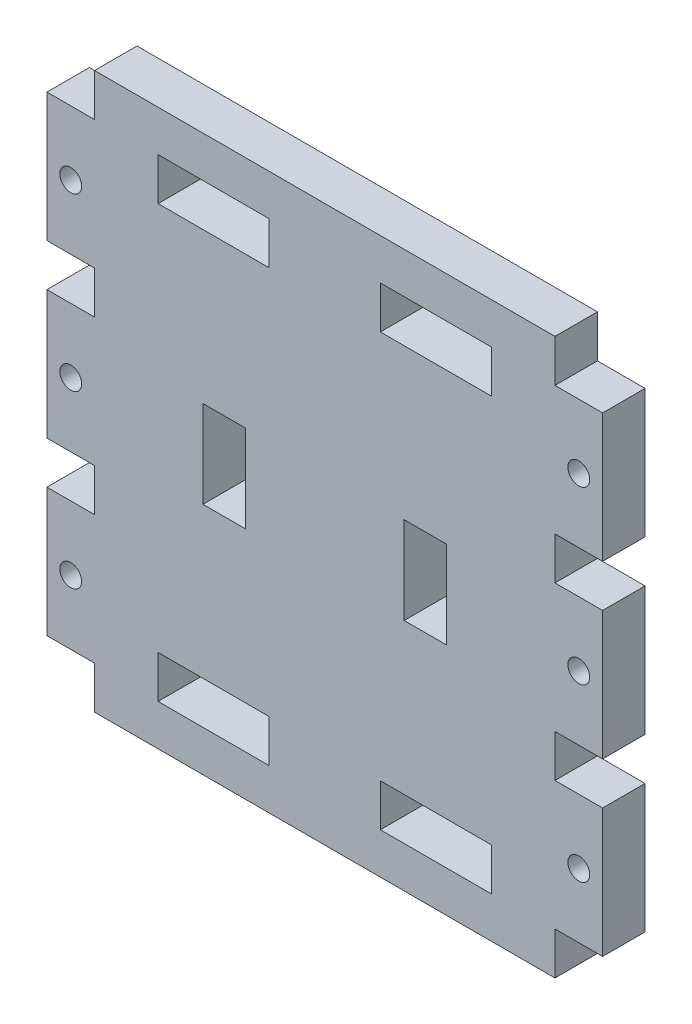
from build123d import *

# Parameters (mm, degrees)
MODEL_R             = 1.375
MODEL_W             = 14
MODEL_H             = 5.35
MODEL_W_2           = 5.35
MODEL_H_2           = 11
BOSS_EXTRUDE1_DEPTH = 5.35


with BuildPart() as part:
    # Model → Boss-Extrude1 (new body)
    with BuildSketch(Plane.XY):
        Polygon((0, 0), (58, 0), (58, 5.35), (64, 5.35), (64, 21.55), (58, 21.55), (58, 26.9), (64, 26.9), (64, 43.1), (58, 43.1), (58, 48.45), (64, 48.45), (64, 64.65), (58, 64.65), (58, 70), (0, 70), (0, 64.65), (-6, 64.65), (-6, 48.45), (0, 48.45), (0, 43.1), (-6, 43.1), (-6, 26.9), (0, 26.9), (0, 21.55), (-6, 21.55), (-6, 5.35), (0, 5.35), align=None)
        with Locations((-3, 56.55)):
            Circle(MODEL_R, mode=Mode.SUBTRACT)
        with Locations(Location((61, 56.55, 0), (0, 0, 180))):
            Circle(MODEL_R, mode=Mode.SUBTRACT)
        with Locations((61, 13.45)):
            Circle(MODEL_R, mode=Mode.SUBTRACT)
        with Locations(Location((-3, 13.45, 0), (0, 0, 180))):
            Circle(MODEL_R, mode=Mode.SUBTRACT)
        with Locations((-3, 35)):
            Circle(MODEL_R, mode=Mode.SUBTRACT)
        with Locations(Location((61, 35, 0), (0, 0, 180))):
            Circle(MODEL_R, mode=Mode.SUBTRACT)
        with Locations((15, 62.155)):
            Rectangle(MODEL_W, MODEL_H, mode=Mode.SUBTRACT)
        with Locations((43, 62.155)):
            Rectangle(MODEL_W, MODEL_H, mode=Mode.SUBTRACT)
        with Locations((43, 7.845)):
            Rectangle(MODEL_W, MODEL_H, mode=Mode.SUBTRACT)
        with Locations((15, 7.845)):
            Rectangle(MODEL_W, MODEL_H, mode=Mode.SUBTRACT)
        with Locations((16.325, 35)):
            Rectangle(MODEL_W_2, MODEL_H_2, mode=Mode.SUBTRACT)
        with Locations((41.675, 35)):
            Rectangle(MODEL_W_2, MODEL_H_2, mode=Mode.SUBTRACT)
    extrude(amount=BOSS_EXTRUDE1_DEPTH)


solid = part.part
